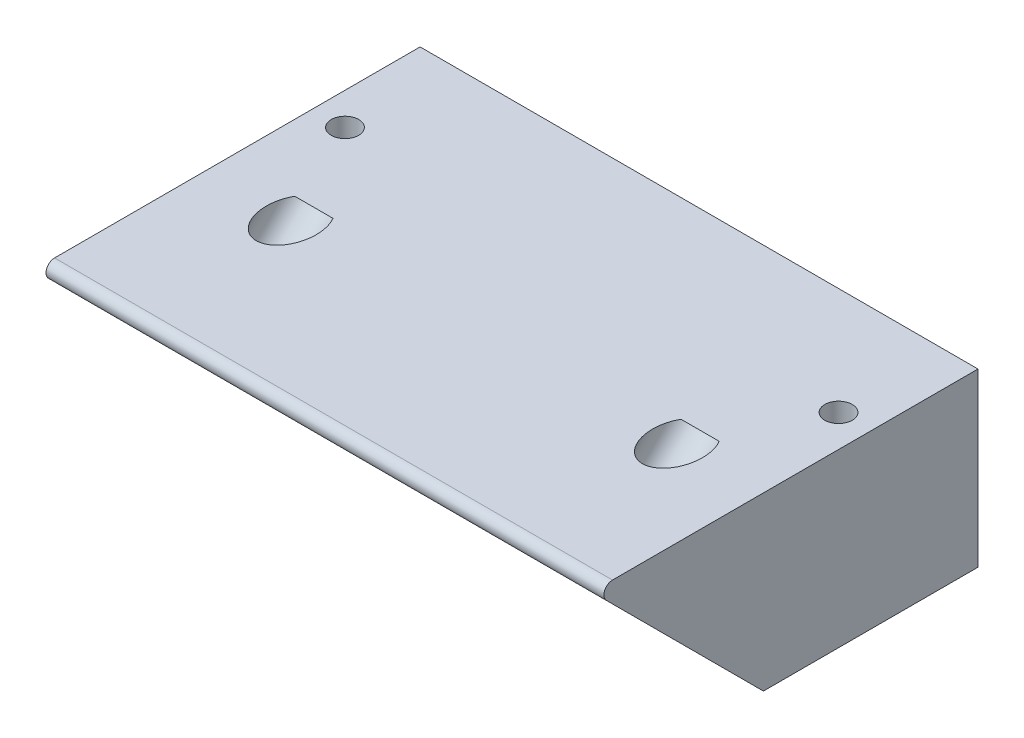
from build123d import *

# Parameters (mm, degrees)
SKETCH_1_W               = 65
SKETCH_1_H               = 25
EXTRUDE_1_DEPTH          = 20
EXTRUDE_2_DEPTH          = 65
SKETCH_3_W               = 50
SKETCH_3_H               = 20
CUT_EXTRUDE_1_DEPTH      = 15
CUT_EXTRUDE_2_DEPTH      = 50.33938589
CUT_EXTRUDE_2_DEPTH_BACK = 50.33938589
SKETCH_4_R               = 1.6
CUT_EXTRUDE_START        = -7
SKETCH_5_R               = 2.9
CUT_EXTRUDE_3_DEPTH      = 9
CUT_EXTRUDE_4_DEPTH      = 51.124844139
CUT_EXTRUDE_4_DEPTH_BACK = 51.124844139
SKETCH_6_R               = 1.6
FILLET_1_R               = 1


with BuildPart() as part:
    # 草图1 → 凸台-拉伸1 (new body)
    with BuildSketch(Plane(origin=(0, 0, 0), x_dir=(1, 0, 0), z_dir=(0, 1, 0))):
        Rectangle(SKETCH_1_W, SKETCH_1_H)
    extrude(amount=EXTRUDE_1_DEPTH)

    # 草图2 → 凸台-拉伸2 (add)
    with BuildSketch(Plane(origin=(32.5, 0, 0), x_dir=(0, 0, -1), z_dir=(1, 0, 0))):
        Polygon((-12.5, 0), (-32.5, 20), (-12.5, 20), align=None)
    extrude(amount=-EXTRUDE_2_DEPTH)

    # 草图3 → 切除-拉伸1 (cut)
    with BuildSketch(Plane.XZ):
        with Locations((0, -2.5)):
            Rectangle(SKETCH_3_W, SKETCH_3_H)
    extrude(amount=-CUT_EXTRUDE_1_DEPTH, mode=Mode.SUBTRACT)

    # 草图4 → 切除-拉伸2 (cut, two sides: drawn at the far end of the back side and taken through both)
    with BuildSketch(Plane(origin=(0, -6.25, 6.25), x_dir=(1, 0, 0), z_dir=(0, -0.7071067811865489, 0.7071067811865462)).offset(-CUT_EXTRUDE_2_DEPTH_BACK)):
        with Locations(Location((-22.5, 22.980970389, 0), (0, 0, 270))):
            Circle(SKETCH_4_R)
        with Locations(Location((22.5, 22.980970389, 0), (0, 0, 270))):
            Circle(SKETCH_4_R)
    extrude(amount=CUT_EXTRUDE_2_DEPTH + CUT_EXTRUDE_2_DEPTH_BACK, mode=Mode.SUBTRACT)

    # 草图5 → 切除-拉伸3 (cut)
    with BuildSketch(Plane(origin=(0, -6.25, 6.25), x_dir=(1, 0, 0), z_dir=(0, -0.7071067811865489, 0.7071067811865462)).offset(CUT_EXTRUDE_START)):
        with Locations(Location((-22.5, 22.980970389, 0), (0, 0, 270))):
            Circle(SKETCH_5_R)
        with Locations(Location((22.5, 22.980970389, 0), (0, 0, 320.160225214))):
            Circle(SKETCH_5_R)
    extrude(amount=-CUT_EXTRUDE_3_DEPTH, mode=Mode.SUBTRACT)

    # 草图6 → 切除-拉伸4 (cut, two sides: drawn at the far end of the back side and taken through both)
    with BuildSketch(Plane.XZ.offset(-CUT_EXTRUDE_4_DEPTH_BACK)):
        with Locations(Location((-28.75, 0, 0), (0, 0, 270))):
            Circle(SKETCH_6_R)
        with Locations(Location((28.75, 0, 0), (0, 0, 270))):
            Circle(SKETCH_6_R)
    extrude(amount=CUT_EXTRUDE_4_DEPTH + CUT_EXTRUDE_4_DEPTH_BACK, mode=Mode.SUBTRACT)

    # 圆角1
    fillet_1_edges = [part.edges().sort_by_distance(p)[0] for p in [
        (0, 20, 32.5),
    ]]
    fillet(fillet_1_edges, radius=FILLET_1_R)


solid = part.part
